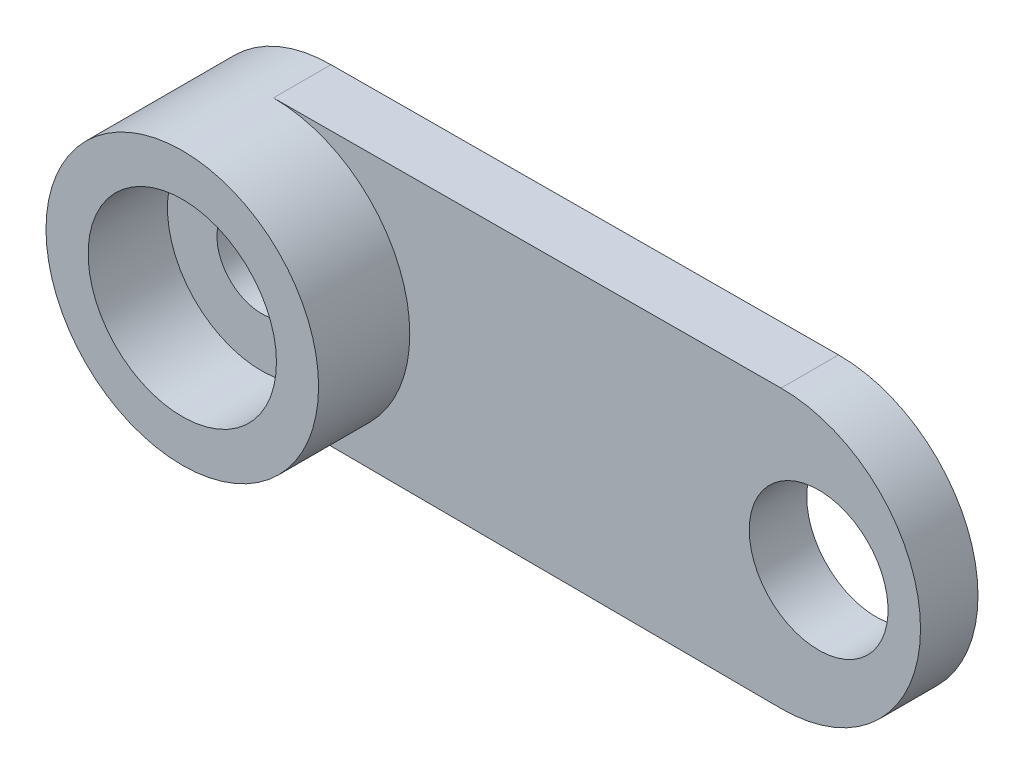
from build123d import *

# Parameters (mm, degrees)
SKETCH2_R           = 3.4925
BOSS_EXTRUDE1_DEPTH = 3.81
SKETCH3_R           = 2.413
CUT_EXTRUDE1_DEPTH  = 2.032
SKETCH4_R           = 1.143
CUT_EXTRUDE2_DEPTH  = 2.2225
SKETCH5_R           = 2.286
CUT_EXTRUDE3_DEPTH  = 1.016
SKETCH6_R           = 1.778
BOSS_EXTRUDE2_DEPTH = 1.4732


with BuildPart() as part:
    # Sketch2 → Boss-Extrude1 (new body)
    with BuildSketch(Plane.XY):
        with Locations(Location((0, 0, 0), (0, 0, 180))):
            Circle(SKETCH2_R)
    extrude(amount=BOSS_EXTRUDE1_DEPTH)

    # Sketch3 → Cut-Extrude1 (cut)
    with BuildSketch(Plane.XY.offset(3.81)):
        Circle(SKETCH3_R)
    extrude(amount=-CUT_EXTRUDE1_DEPTH, mode=Mode.SUBTRACT)

    # Sketch4 → Cut-Extrude2 (cut)
    with BuildSketch(Plane.XY.offset(1.778)):
        Circle(SKETCH4_R)
    extrude(amount=-CUT_EXTRUDE2_DEPTH, mode=Mode.SUBTRACT)

    # Sketch5 → Cut-Extrude3 (cut)
    with BuildSketch(Plane(origin=(0, 0, 0), x_dir=(-1, 0, 0), z_dir=(0, 0, -1))):
        Circle(SKETCH5_R)
    extrude(amount=-CUT_EXTRUDE3_DEPTH, mode=Mode.SUBTRACT)

    # Sketch6 → Boss-Extrude2 (add)
    with BuildSketch(Plane(origin=(0, 0, 0), x_dir=(-1, 0, 0), z_dir=(0, 0, -1))):
        with BuildLine():
            Line((0, 3.4925), (-13.006826988, 3.55595768))
            ThreePointArc((-13.006826988, 3.55595768), (-16.580175786, 0), (-13.006826988, -3.55595768))
            Line((-13.006826988, -3.55595768), (0, -3.4925))
            ThreePointArc((0, -3.4925), (-3.4925, 0), (0, 3.4925))
        make_face()
        with Locations((-13.97, 0)):
            Circle(SKETCH6_R, mode=Mode.SUBTRACT)
    extrude(amount=-BOSS_EXTRUDE2_DEPTH)


solid = part.part
